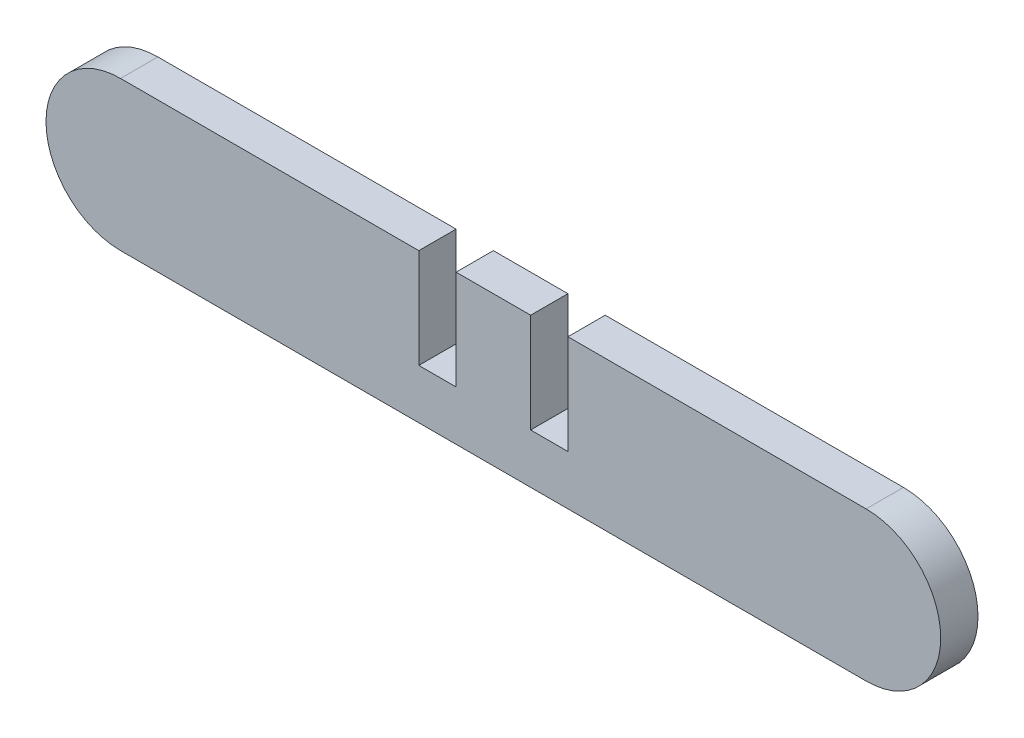
from build123d import *

# Parameters (mm, degrees)
EXTRUDE_1_DEPTH     = 3
SKETCH_2_W          = 3
SKETCH_2_H          = 8
CUT_EXTRUDE_1_DEPTH = 4


with BuildPart() as part:
    # 草图1 → 凸台-拉伸1 (new body)
    with BuildSketch(Plane.XY):
        with BuildLine():
            Line((30, -6), (-30, -6))
            ThreePointArc((-30, -6), (-36, 0), (-30, 6))
            Line((-30, 6), (30, 6))
            ThreePointArc((30, 6), (36, 0), (30, -6))
        make_face()
    extrude(amount=EXTRUDE_1_DEPTH)

    # 草图2 → 切除-拉伸1 (cut)
    with BuildSketch(Plane.XY.offset(3)):
        with Locations((-4.5, 2)):
            Rectangle(SKETCH_2_W, SKETCH_2_H)
        with Locations((4.5, 2)):
            Rectangle(SKETCH_2_W, SKETCH_2_H)
    extrude(amount=-CUT_EXTRUDE_1_DEPTH, mode=Mode.SUBTRACT)


solid = part.part
